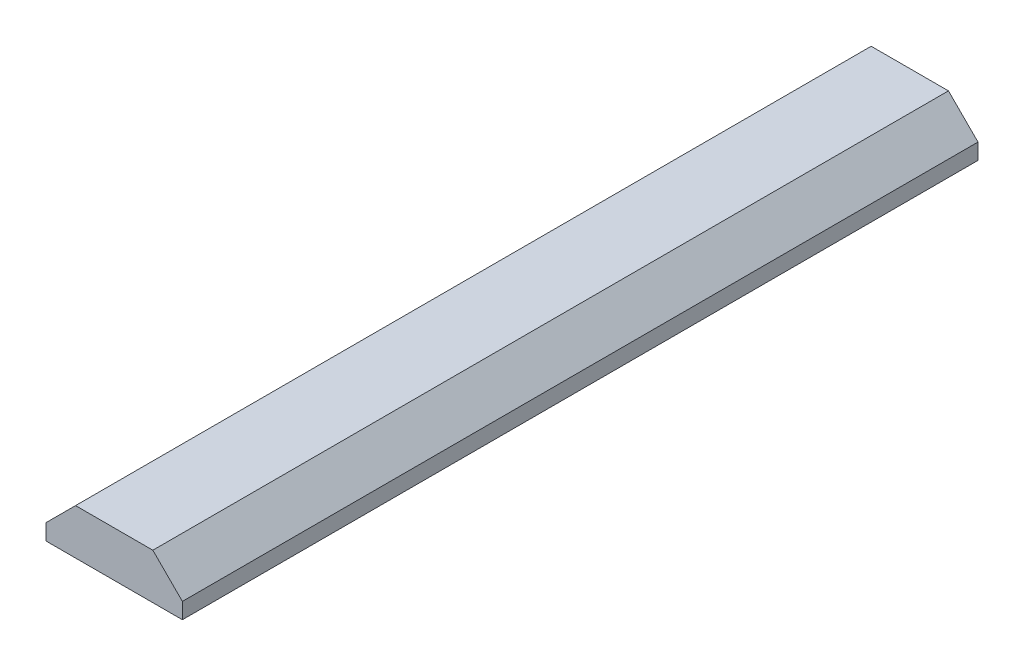
from build123d import *

# Parameters (mm, degrees)
AUFSATZ_LINEAR_AUSTRAGEN1_DEPTH = 70


with BuildPart() as part:
    # Skizze1 → Aufsatz-Linear austragen1 (new body)
    with BuildSketch(Plane.XY):
        Polygon((3.4, 1.808858787), (-3.4, 1.808858787), (-6, -0.791141213), (-6, -2.191141213), (6, -2.191141213), (6, -0.791141213), align=None)
    extrude(amount=AUFSATZ_LINEAR_AUSTRAGEN1_DEPTH)


solid = part.part
